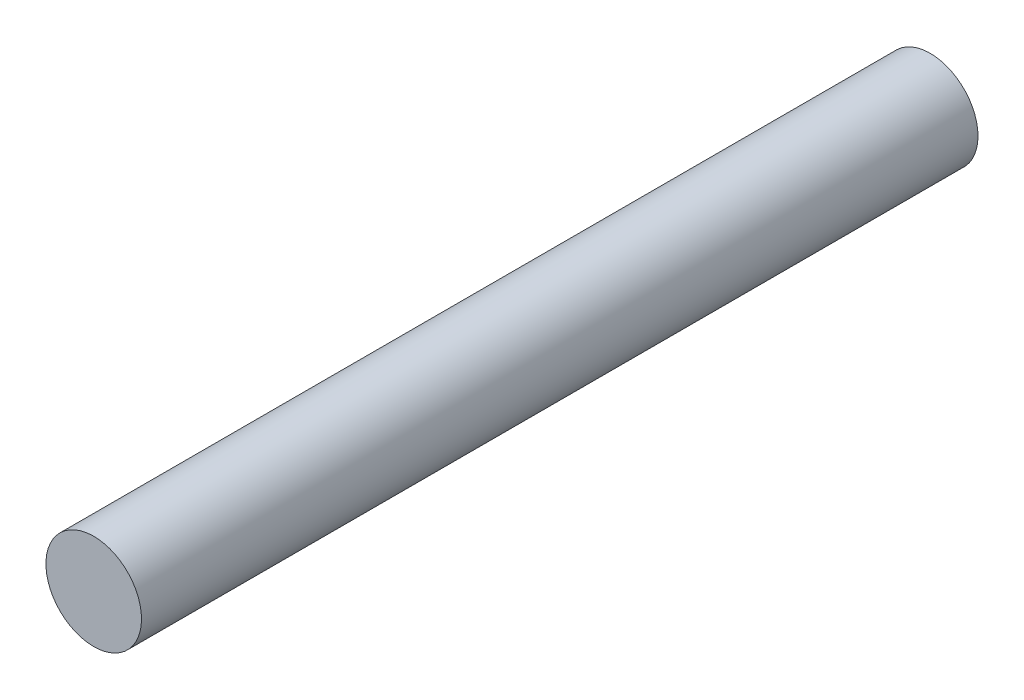
from build123d import *

# Parameters (mm, degrees)
SKETCH1_R           = 1
BOSS_EXTRUDE1_DEPTH = 17.5


with BuildPart() as part:
    # Sketch1 → Boss-Extrude1 (new body)
    with BuildSketch(Plane.XY):
        Circle(SKETCH1_R)
    extrude(amount=BOSS_EXTRUDE1_DEPTH)


solid = part.part
